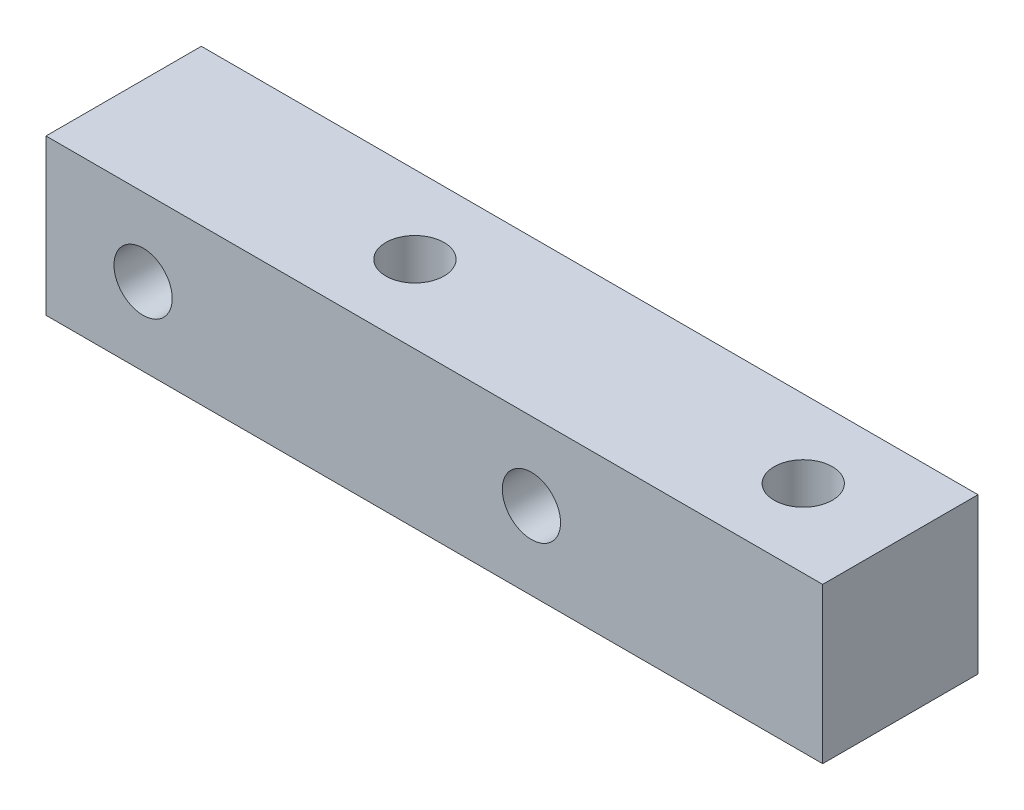
from build123d import *

# Parameters (mm, degrees)
SKETCH_1_W          = 40
SKETCH_1_H          = 8
SKETCH_1_R          = 1.5
EXTRUDE_1_DEPTH     = 8
SKETCH_2_R          = 1.5
CUT_EXTRUDE_1_DEPTH = 8


with BuildPart() as part:
    # 草图1 → 凸台-拉伸1 (new body)
    with BuildSketch(Plane(origin=(0, 0, 0), x_dir=(1, 0, 0), z_dir=(0, 1, 0))):
        Rectangle(SKETCH_1_W, SKETCH_1_H)
        with Locations(Location((15, 0, 0), (0, 0, 270))):
            Circle(SKETCH_1_R, mode=Mode.SUBTRACT)
        with Locations(Location((-5, 0, 0), (0, 0, 270))):
            Circle(SKETCH_1_R, mode=Mode.SUBTRACT)
    extrude(amount=EXTRUDE_1_DEPTH)

    # 草图2 → 切除-拉伸1 (cut)
    with BuildSketch(Plane.XY.offset(4)):
        with Locations((-15, 4)):
            Circle(SKETCH_2_R)
        with Locations((5, 4)):
            Circle(SKETCH_2_R)
    extrude(amount=-CUT_EXTRUDE_1_DEPTH, mode=Mode.SUBTRACT)


solid = part.part
